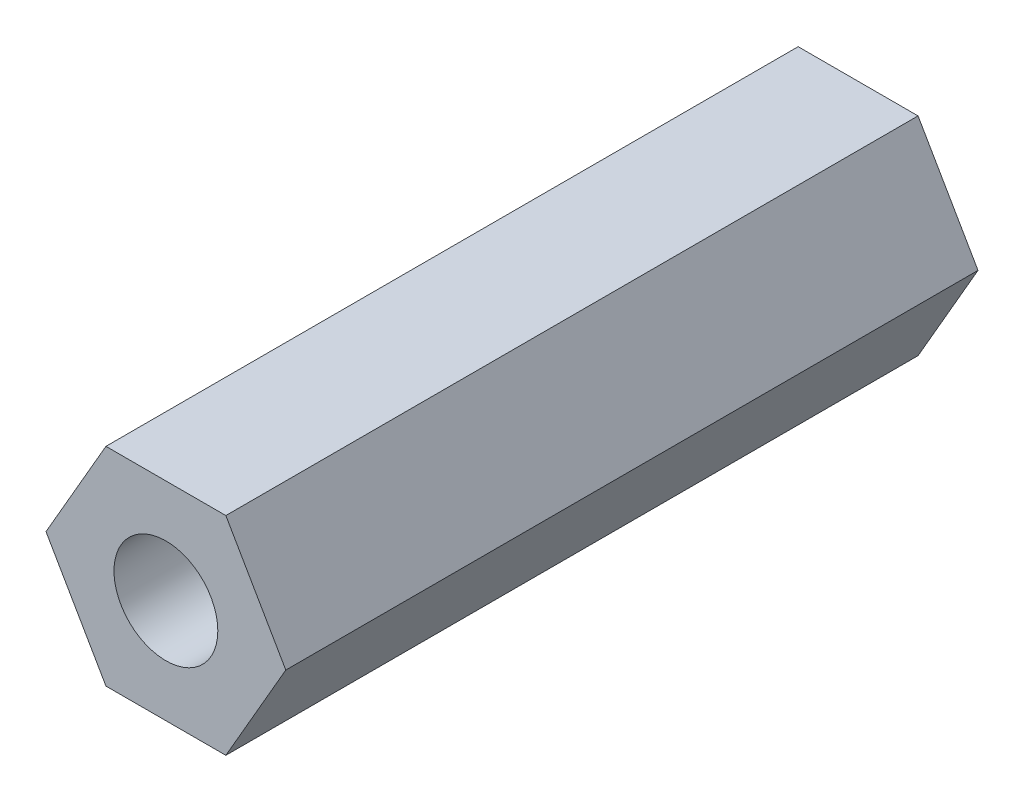
from build123d import *

# Parameters (mm, degrees)
SKETCH1_R           = 2.5
SKETCH1_R_2         = 1.5
BOSS_EXTRUDE1_DEPTH = 20


with BuildPart() as part:
    # Sketch1 → Boss-Extrude1 (new body)
    # profile 1 of 2: a face of its own
    with BuildSketch(Plane.XY):
        Polygon((-1.732050808, -3), (1.732050808, -3), (3.464101615, 0), (1.732050808, 3), (-1.732050808, 3), (-3.464101615, 0), align=None)
        Circle(SKETCH1_R, mode=Mode.SUBTRACT)
    # profile 2 of 2: a face of its own
    with BuildSketch(Plane.XY):
        Circle(SKETCH1_R)
        Circle(SKETCH1_R_2, mode=Mode.SUBTRACT)
    extrude(amount=BOSS_EXTRUDE1_DEPTH)


solid = part.part
